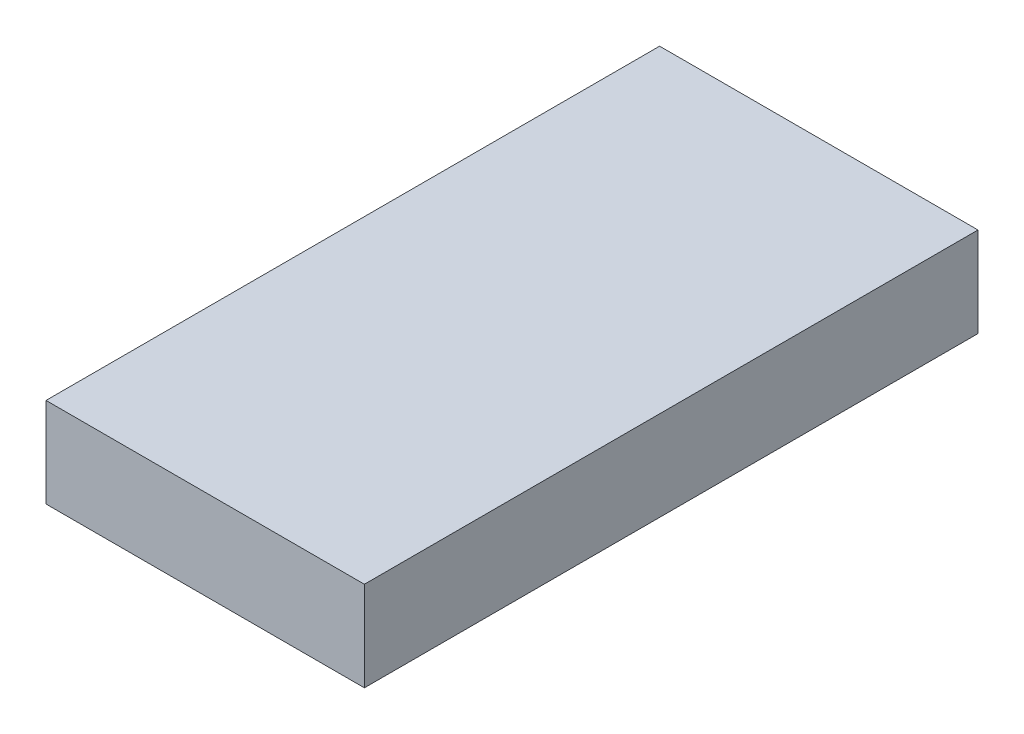
from build123d import *

# Parameters (mm, degrees)
SKETCH1_W           = 43.999912
SKETCH1_H           = 84.7979
BOSS_EXTRUDE1_DEPTH = 12.4000006
SKETCH2_W           = 0.569871795
SKETCH2_H           = 3.256410256
SKETCH2_W_2         = 0.569871794
CUT_EXTRUDE1_DEPTH  = 0.254


with BuildPart() as part:
    # Sketch1 → Boss-Extrude1 (new body)
    with BuildSketch(Plane(origin=(0, 0, 0), x_dir=(1, 0, 0), z_dir=(0, 1, 0))):
        with Locations((0.101597209, -0.465922527)):
            Rectangle(SKETCH1_W, SKETCH1_H)
    extrude(amount=BOSS_EXTRUDE1_DEPTH)

    # Sketch2 → Cut-Extrude1 (cut)
    # profile 1 of 10: a face of its own
    with BuildSketch(Plane.ZY.offset(21.898358791)):
        with BuildLine():
            Line((8.672564835, 8.520192608), (9.161026374, 8.520192608))
            Line((9.161026374, 8.520192608), (9.161026374, 8.234620693))
            add(Edge.make_bspline(
                [(9.161026374, 8.234620693), (9.174844013, 8.259999547), (9.201851162, 8.309603572), (9.25146556, 8.376187151), (9.30846459, 8.432261984), (9.3708001, 8.479000926), (9.438661017, 8.515429343), (9.510230148, 8.541389182), (9.584895218, 8.55825948), (9.635829198, 8.560011985), (9.661572247, 8.560897736)],
                knots=[0, 0, 0, 0, 1.09866127, 2.147379032, 3.14564304, 4.131443017, 5.102343063, 6.064490016, 7.021754664, 8, 8, 8, 8], degree=3))
            add(Edge.make_bspline(
                [(9.661572247, 8.560897736), (9.680264913, 8.560022429), (9.718329855, 8.558239991), (9.776346183, 8.547878655), (9.835199585, 8.529143387), (9.873930196, 8.512274769), (9.893718681, 8.503656149)],
                knots=[0, 0, 0, 0, 0.931404136, 1.896671404, 2.925354185, 4, 4, 4, 4], degree=3))
            Line((9.893718681, 8.503656149), (9.716905781, 8.02091877))
            add(Edge.make_bspline(
                [(9.716905781, 8.02091877), (9.701101232, 8.028554763), (9.671394765, 8.042907492), (9.628266133, 8.05984519), (9.589125111, 8.070179746), (9.564310422, 8.071721752), (9.552813233, 8.072436197)],
                knots=[0, 0, 0, 0, 1.214386998, 2.282580073, 3.20428172, 4, 4, 4, 4], degree=3))
            add(Edge.make_bspline(
                [(9.552813233, 8.072436197), (9.54195765, 8.071962768), (9.520602849, 8.071031451), (9.48908376, 8.063050383), (9.459399341, 8.049287277), (9.430119103, 8.031655373), (9.403552931, 8.007145707), (9.377003168, 7.978771418), (9.353606096, 7.943739583), (9.328915399, 7.904747372), (9.307892154, 7.857020941), (9.289865368, 7.800045417), (9.273803357, 7.733161555), (9.262750501, 7.656014234), (9.252067471, 7.569349987), (9.24570867, 7.472532711), (9.240969375, 7.365868549), (9.240679599, 7.291413115), (9.240528577, 7.252609475)],
                knots=[0, 0, 0, 0, 0.544232178, 1.070598461, 1.618251235, 2.182094276, 2.777567932, 3.425210017, 4.127676488, 4.886675562, 5.738955394, 6.734782583, 7.883056018, 9.186093582, 10.642914445, 12.264202625, 14.053029461, 16, 16, 16, 16], degree=3))
            Line((9.240528577, 7.252609475), (9.24243663, 7.139398337))
            Line((9.24243663, 7.139398337), (9.24243663, 6.2000003))
            Line((9.24243663, 6.2000003), (8.672564835, 6.2000003))
            Line((8.672564835, 6.2000003), (8.672564835, 8.520192608))
        make_face()
    # profile 2 of 10: a face of its own
    with BuildSketch(Plane.ZY.offset(21.898358791)):
        with BuildLine():
            Line((8.2636055, 7.217628505), (6.433782784, 7.217628505))
            add(Edge.make_bspline(
                [(6.433782784, 7.217628505), (6.437513645, 7.196367003), (6.44484508, 7.154586475), (6.460765554, 7.093896631), (6.481082465, 7.036703548), (6.505431005, 6.98293077), (6.533400655, 6.932294023), (6.566024936, 6.885030813), (6.602890036, 6.841182885), (6.643782813, 6.800940808), (6.688021657, 6.764883035), (6.735392027, 6.733294146), (6.785942806, 6.70739319), (6.839094449, 6.685561371), (6.89524412, 6.668268359), (6.954474458, 6.656341698), (7.016628451, 6.649296575), (7.058969651, 6.648277579), (7.080612712, 6.64775671)],
                knots=[0, 0, 0, 0, 1.091296461, 2.144483647, 3.168565212, 4.157007626, 5.126487748, 6.090021542, 7.05641414, 8.019231907, 8.98705074, 9.938580405, 10.892824166, 11.854447369, 12.841318655, 13.858982407, 14.905600794, 16, 16, 16, 16], degree=3))
            add(Edge.make_bspline(
                [(7.080612712, 6.64775671), (7.106737356, 6.648446426), (7.158184474, 6.64980468), (7.233554884, 6.661850372), (7.30644905, 6.68004486), (7.376177136, 6.707101592), (7.443546832, 6.740782467), (7.507449027, 6.782744692), (7.568989816, 6.831761996), (7.60653695, 6.869544514), (7.625679819, 6.888807391)],
                knots=[0, 0, 0, 0, 1.021034703, 2.010718019, 2.977989445, 3.954245119, 4.929443971, 5.918328161, 6.938689359, 8, 8, 8, 8], degree=3))
            Line((7.625679819, 6.888807391), (8.10269304, 6.661749098))
            add(Edge.make_bspline(
                [(8.10269304, 6.661749098), (8.087674557, 6.64099586), (8.057915986, 6.599874081), (8.009336117, 6.542005118), (7.95863993, 6.488011028), (7.905789616, 6.438246938), (7.850718148, 6.392854657), (7.793578721, 6.351281223), (7.733536266, 6.314642868), (7.671791321, 6.28116705), (7.607067504, 6.252468386), (7.539543934, 6.227995178), (7.469506611, 6.205871607), (7.396071115, 6.189014658), (7.319848943, 6.175670834), (7.240657757, 6.166194951), (7.158507993, 6.160342153), (7.102671278, 6.159648311), (7.074252535, 6.159295172)],
                knots=[0, 0, 0, 0, 1.028154879, 2.037251081, 3.030720504, 4.000128189, 4.949298328, 5.894184978, 6.834267904, 7.770992897, 8.712077017, 9.673380525, 10.653304757, 11.658697181, 12.695551717, 13.758623199, 14.859225354, 16, 16, 16, 16], degree=3))
            add(Edge.make_bspline(
                [(7.074252535, 6.159295172), (7.030530767, 6.160186527), (6.944904204, 6.161932195), (6.819659876, 6.178134493), (6.700712502, 6.204999648), (6.587726217, 6.241518701), (6.481189422, 6.289735292), (6.381049392, 6.348708182), (6.286305585, 6.417306744), (6.199852953, 6.496970677), (6.121092054, 6.583680133), (6.051913378, 6.676800167), (5.994025647, 6.775680186), (5.946487078, 6.87966578), (5.909538451, 6.989023111), (5.882900634, 7.103799902), (5.866571333, 7.223941333), (5.864807687, 7.305771058), (5.863910989, 7.347376101)],
                knots=[0, 0, 0, 0, 1.103565453, 2.161269334, 3.182010356, 4.179077853, 5.15417608, 6.128274628, 7.109042802, 8.101804412, 9.090965879, 10.063106201, 11.02526161, 11.978650795, 12.945248442, 13.93468508, 14.949922959, 16, 16, 16, 16], degree=3))
            add(Edge.make_bspline(
                [(5.863910989, 7.347376101), (5.864816512, 7.390038382), (5.866598089, 7.473974503), (5.882760038, 7.596890054), (5.909612095, 7.714168115), (5.946668805, 7.82597019), (5.993486208, 7.932645947), (6.052110462, 8.033262103), (6.121057725, 8.128168947), (6.199534889, 8.216922496), (6.286353761, 8.29703227), (6.378607015, 8.368426089), (6.477331211, 8.427916157), (6.581409693, 8.475984095), (6.690176737, 8.515038082), (6.80488954, 8.541025248), (6.92467531, 8.558474075), (7.006558225, 8.560081003), (7.048175813, 8.560897736)],
                knots=[0, 0, 0, 0, 1.079208495, 2.12329425, 3.130605359, 4.119693003, 5.099659317, 6.073216462, 7.060498243, 8.06384408, 9.066070512, 10.045757761, 11.010926815, 11.975797609, 12.942977511, 13.929384301, 14.947594487, 16, 16, 16, 16], degree=3))
            add(Edge.make_bspline(
                [(7.048175813, 8.560897736), (7.092107038, 8.559992552), (7.178361471, 8.558215316), (7.304478087, 8.542144578), (7.424215257, 8.515115601), (7.538083128, 8.478912322), (7.644627561, 8.429477729), (7.74618966, 8.371956069), (7.84033339, 8.301874697), (7.928062223, 8.222600613), (8.007255424, 8.134648765), (8.076479057, 8.039106119), (8.135379849, 7.936905117), (8.183119525, 7.827631311), (8.220030212, 7.711612753), (8.246692688, 7.589000114), (8.262897435, 7.459327036), (8.264628263, 7.370532448), (8.265513553, 7.325115484)],
                knots=[0, 0, 0, 0, 1.080001299, 2.120471247, 3.119684163, 4.095710327, 5.052285597, 6.002875087, 6.961153713, 7.931888285, 8.906493152, 9.865905668, 10.82813294, 11.801621613, 12.7925306, 13.817193356, 14.883530496, 16, 16, 16, 16], degree=3))
            Line((8.265513553, 7.325115484), (8.2636055, 7.217628505))
        make_face()
        with BuildLine():
            add(Edge.make_bspline(
                [(7.695641758, 7.665384915), (7.684887929, 7.694405145), (7.663506515, 7.75210492), (7.61520679, 7.831716531), (7.551114601, 7.900663419), (7.476570788, 7.961702647), (7.391399813, 8.011245896), (7.298285563, 8.047116818), (7.198404986, 8.068625472), (7.12969253, 8.07114806), (7.0946051, 8.072436197)],
                knots=[0, 0, 0, 0, 0.954238005, 1.897273737, 2.851915805, 3.847685534, 4.862635127, 5.880135777, 6.917509367, 8, 8, 8, 8], degree=3))
            add(Edge.make_bspline(
                [(7.0946051, 8.072436197), (7.056283912, 8.071198784), (6.981373971, 8.068779899), (6.87332148, 8.043054169), (6.77139827, 8.004659284), (6.711310121, 7.965073343), (6.681193641, 7.945232672)],
                knots=[0, 0, 0, 0, 1.044195649, 2.041185066, 3.018232172, 4, 4, 4, 4], degree=3))
            add(Edge.make_bspline(
                [(6.681193641, 7.945232672), (6.662403207, 7.930121582), (6.622342962, 7.897905511), (6.570316606, 7.833637507), (6.519070212, 7.755823382), (6.489933812, 7.696718057), (6.474487912, 7.665384915)],
                knots=[0, 0, 0, 0, 0.82159062, 1.751589201, 2.808063854, 4, 4, 4, 4], degree=3))
            Line((6.474487912, 7.665384915), (7.695641758, 7.665384915))
        make_face(mode=Mode.SUBTRACT)
    # profile 3 of 10: a face of its own
    with BuildSketch(Plane.ZY.offset(21.898358791)):
        with Locations((5.131218682, 7.828205428)):
            Rectangle(SKETCH2_W, SKETCH2_H)
    # profile 4 of 10: a face of its own
    with BuildSketch(Plane.ZY.offset(21.898358791)):
        with Locations((4.072885348, 7.828205428)):
            Rectangle(SKETCH2_W_2, SKETCH2_H)
    # profile 5 of 10: a face of its own
    with BuildSketch(Plane.ZY.offset(21.898358791)):
        with BuildLine():
            add(Edge.make_bspline(
                [(2.12539937, 8.560897736), (2.152341809, 8.560418277), (2.205700045, 8.55946873), (2.285170472, 8.551564624), (2.363251572, 8.53866875), (2.440392146, 8.521970843), (2.515875871, 8.498574578), (2.590098651, 8.470514375), (2.66372413, 8.438297982), (2.73492494, 8.399949205), (2.804215453, 8.358356458), (2.869906983, 8.312476247), (2.931454007, 8.262668943), (2.989999047, 8.210089369), (3.042813811, 8.152448381), (3.093273444, 8.092523364), (3.138651737, 8.028167413), (3.180665499, 7.960948735), (3.218070049, 7.891256042), (3.250549021, 7.81957414), (3.278737716, 7.746894084), (3.300808899, 7.67233058), (3.319081804, 7.596866846), (3.330613306, 7.519578132), (3.338811404, 7.441258387), (3.339730671, 7.388527089), (3.34019304, 7.362004507)],
                knots=[0, 0, 0, 0, 1.022364134, 2.024744242, 3.027414945, 4.024939316, 5.017584196, 6.023349371, 7.035562955, 8.064994934, 9.090267829, 10.101425541, 11.102933353, 12.093946398, 13.084502048, 14.067315274, 15.065326281, 16.070028806, 17.074376865, 18.064572984, 19.055292013, 20.030201733, 21.013838017, 21.999348303, 22.993720005, 24, 24, 24, 24], degree=3))
            add(Edge.make_bspline(
                [(3.34019304, 7.362004507), (3.339705086, 7.335274716), (3.338734923, 7.282129834), (3.330909903, 7.203073395), (3.317964667, 7.125421228), (3.301202673, 7.048715872), (3.277893963, 6.973938844), (3.250660224, 6.899987902), (3.217229738, 6.827871025), (3.180269872, 6.756801486), (3.137985979, 6.688870645), (3.092646967, 6.623870003), (3.042398683, 6.563504833), (2.990006716, 6.505903044), (2.932985997, 6.45301247), (2.872246682, 6.403974309), (2.808314605, 6.358189047), (2.740730028, 6.316730894), (2.670358596, 6.280303094), (2.598387109, 6.247460459), (2.524394719, 6.22011662), (2.448534557, 6.197818472), (2.370760616, 6.180553575), (2.291244601, 6.168825325), (2.21015776, 6.160668462), (2.15552464, 6.159755882), (2.127943441, 6.159295172)],
                knots=[0, 0, 0, 0, 1.012026251, 2.012137606, 3.004615893, 3.992048833, 4.982446996, 5.968083444, 6.973977695, 7.990229942, 8.999482246, 10.001782172, 10.988562221, 11.971415814, 12.948383116, 13.930088534, 14.925840678, 15.924049238, 16.929462851, 17.924729459, 18.917889337, 19.913673841, 20.916777188, 21.931792057, 22.95587778, 24, 24, 24, 24], degree=3))
            add(Edge.make_bspline(
                [(2.127943441, 6.159295172), (2.087614104, 6.160478917), (2.008124366, 6.162812098), (1.891054776, 6.178793774), (1.778589545, 6.206302429), (1.670545413, 6.244648888), (1.566782027, 6.293788446), (1.468204952, 6.354606111), (1.373833614, 6.425904557), (1.285302596, 6.507081164), (1.20419619, 6.596139254), (1.133339987, 6.691208221), (1.073177336, 6.790863143), (1.023762366, 6.895217659), (0.985624086, 7.004414868), (0.958081741, 7.118128309), (0.942080525, 7.236677612), (0.939767077, 7.317223429), (0.938590476, 7.358188401)],
                knots=[0, 0, 0, 0, 1.029999031, 2.030143771, 3.011211297, 3.982305373, 4.953580601, 5.938004764, 6.935448627, 7.970290061, 9.001484052, 10.007591832, 10.993831261, 11.969999897, 12.951306496, 13.942897864, 14.953773953, 16, 16, 16, 16], degree=3))
            add(Edge.make_bspline(
                [(0.938590476, 7.358188401), (0.939808109, 7.401930011), (0.942201342, 7.48790327), (0.961204665, 7.613856053), (0.991550921, 7.734449874), (1.035111061, 7.849347393), (1.090755309, 7.958760524), (1.158684324, 8.062458501), (1.239233817, 8.160464815), (1.300918599, 8.219742393), (1.332285388, 8.249885116)],
                knots=[0, 0, 0, 0, 1.043912699, 2.05178951, 3.033892, 4.007821512, 4.978932272, 5.95884105, 6.962068106, 8, 8, 8, 8], degree=3))
            add(Edge.make_bspline(
                [(1.332285388, 8.249885116), (1.361067553, 8.274870043), (1.417848805, 8.324160131), (1.510099652, 8.386676528), (1.604554109, 8.440671622), (1.702344255, 8.485065632), (1.803742702, 8.518537999), (1.908229841, 8.542902888), (2.015783946, 8.557868516), (2.088675212, 8.559882865), (2.12539937, 8.560897736)],
                knots=[0, 0, 0, 0, 1.048115528, 2.067714963, 3.060638214, 4.039924844, 5.017819947, 5.994373833, 6.98952318, 8, 8, 8, 8], degree=3))
        make_face()
        with BuildLine():
            add(Edge.make_bspline(
                [(2.138119723, 8.031731069), (2.116055851, 8.030997739), (2.072622881, 8.029554171), (2.008688409, 8.021806927), (1.948218512, 8.005928285), (1.890012145, 7.985734997), (1.835098984, 7.958729321), (1.781975154, 7.927126456), (1.733402978, 7.887579359), (1.687031891, 7.844199087), (1.64493728, 7.79602646), (1.609068675, 7.743542418), (1.577019281, 7.688754891), (1.552717852, 7.62965804), (1.532606095, 7.567867154), (1.5189947, 7.502383878), (1.509522119, 7.433939698), (1.508818914, 7.387054965), (1.508462271, 7.363276542)],
                knots=[0, 0, 0, 0, 1.030650113, 2.02884584, 2.99876339, 3.944280128, 4.900564847, 5.851248946, 6.823638398, 7.81794922, 8.81432732, 9.802856497, 10.78262424, 11.771747962, 12.779760563, 13.812642396, 14.89064281, 16, 16, 16, 16], degree=3))
            add(Edge.make_bspline(
                [(1.508462271, 7.363276542), (1.508879592, 7.338659572), (1.509695165, 7.290550431), (1.518140594, 7.220304616), (1.532067385, 7.153641802), (1.551852991, 7.090664971), (1.576736731, 7.030922082), (1.607266194, 6.974748332), (1.643763585, 6.922481474), (1.685142768, 6.874185869), (1.730451206, 6.830347414), (1.780096651, 6.792726892), (1.832000137, 6.760039652), (1.887357803, 6.733786753), (1.945383412, 6.713517385), (2.006249217, 6.698593731), (2.070275069, 6.69055359), (2.113930581, 6.689168677), (2.13621167, 6.688461838)],
                knots=[0, 0, 0, 0, 1.141730614, 2.231293227, 3.276944405, 4.297399982, 5.28939179, 6.275415646, 7.257752684, 8.24146775, 9.222424823, 10.176631434, 11.126518621, 12.063689483, 13.012557477, 13.974037417, 14.965980454, 16, 16, 16, 16], degree=3))
            add(Edge.make_bspline(
                [(2.13621167, 6.688461838), (2.158503903, 6.689088772), (2.202209621, 6.690317925), (2.266310659, 6.699522344), (2.32748729, 6.714008284), (2.386008483, 6.734452103), (2.441401088, 6.761266932), (2.493877154, 6.794110552), (2.543898319, 6.832254341), (2.589814801, 6.876919944), (2.63231881, 6.925366166), (2.669592284, 6.977908938), (2.700739404, 7.034082701), (2.72628562, 7.093534012), (2.746110012, 7.156181153), (2.759806243, 7.222256977), (2.769283888, 7.291556709), (2.769971189, 7.339074684), (2.770321245, 7.363276542)],
                knots=[0, 0, 0, 0, 1.031504075, 2.022346795, 2.991027682, 3.937587355, 4.885570121, 5.833146507, 6.798790848, 7.791235734, 8.792807298, 9.778388351, 10.766749885, 11.760164525, 12.768777521, 13.802286646, 14.880660483, 16, 16, 16, 16], degree=3))
            add(Edge.make_bspline(
                [(2.770321245, 7.363276542), (2.769898616, 7.387469942), (2.76906928, 7.43494524), (2.760623249, 7.504338699), (2.746833131, 7.570200947), (2.726792335, 7.632250758), (2.7020565, 7.691196021), (2.671505935, 7.746735019), (2.634828551, 7.798594206), (2.593248212, 7.846516436), (2.547260572, 7.889739738), (2.498477092, 7.928284431), (2.445782245, 7.960163853), (2.390164616, 7.986443876), (2.331476234, 8.006662603), (2.269782987, 8.021670833), (2.204895804, 8.029596567), (2.160611047, 8.031012132), (2.138119723, 8.031731069)],
                knots=[0, 0, 0, 0, 1.123894411, 2.205445421, 3.243160173, 4.246488011, 5.231014757, 6.210004299, 7.185865357, 8.177612767, 9.153374344, 10.115157457, 11.061423229, 12.009021698, 12.96873347, 13.94135618, 14.954456845, 16, 16, 16, 16], degree=3))
        make_face(mode=Mode.SUBTRACT)
    # profile 6 of 10: a face of its own
    with BuildSketch(Plane.ZY.offset(21.898358791)):
        with BuildLine():
            Line((-0.486089011, 8.520192608), (0.002372527, 8.520192608))
            Line((0.002372527, 8.520192608), (0.002372527, 8.234620693))
            add(Edge.make_bspline(
                [(0.002372527, 8.234620693), (0.016190167, 8.259999547), (0.043197316, 8.309603572), (0.092811714, 8.376187151), (0.149810743, 8.432261984), (0.212146254, 8.479000926), (0.280007171, 8.515429343), (0.351576302, 8.541389182), (0.426241372, 8.55825948), (0.477175352, 8.560011985), (0.502918401, 8.560897736)],
                knots=[0, 0, 0, 0, 1.09866127, 2.147379032, 3.14564304, 4.131443017, 5.102343063, 6.064490016, 7.021754664, 8, 8, 8, 8], degree=3))
            add(Edge.make_bspline(
                [(0.502918401, 8.560897736), (0.521611067, 8.560022429), (0.559676009, 8.558239991), (0.617692337, 8.547878655), (0.676545739, 8.529143387), (0.715276349, 8.512274769), (0.735064835, 8.503656149)],
                knots=[0, 0, 0, 0, 0.931404136, 1.896671404, 2.925354185, 4, 4, 4, 4], degree=3))
            Line((0.735064835, 8.503656149), (0.558251935, 8.02091877))
            add(Edge.make_bspline(
                [(0.558251935, 8.02091877), (0.542447386, 8.028554763), (0.512740919, 8.042907492), (0.469612287, 8.05984519), (0.430471265, 8.070179746), (0.405656576, 8.071721752), (0.394159386, 8.072436197)],
                knots=[0, 0, 0, 0, 1.214386998, 2.282580073, 3.20428172, 4, 4, 4, 4], degree=3))
            add(Edge.make_bspline(
                [(0.394159386, 8.072436197), (0.383303804, 8.071962768), (0.361949003, 8.071031451), (0.330429914, 8.063050383), (0.300745495, 8.049287277), (0.271465257, 8.031655373), (0.244899085, 8.007145707), (0.218349322, 7.978771418), (0.19495225, 7.943739583), (0.170261553, 7.904747372), (0.149238307, 7.857020941), (0.131211522, 7.800045417), (0.115149511, 7.733161555), (0.104096655, 7.656014234), (0.093413625, 7.569349987), (0.087054824, 7.472532711), (0.082315529, 7.365868549), (0.082025752, 7.291413115), (0.081874731, 7.252609475)],
                knots=[0, 0, 0, 0, 0.544232178, 1.070598461, 1.618251235, 2.182094276, 2.777567932, 3.425210017, 4.127676488, 4.886675562, 5.738955394, 6.734782583, 7.883056018, 9.186093582, 10.642914445, 12.264202625, 14.053029461, 16, 16, 16, 16], degree=3))
            Line((0.081874731, 7.252609475), (0.083782784, 7.139398337))
            Line((0.083782784, 7.139398337), (0.083782784, 6.2000003))
            Line((0.083782784, 6.2000003), (-0.486089011, 6.2000003))
            Line((-0.486089011, 6.2000003), (-0.486089011, 8.520192608))
        make_face()
    # profile 7 of 10: a face of its own
    with BuildSketch(Plane.ZY.offset(21.898358791)):
        Polygon((-1.666537729, 9.456410556), (-1.096665934, 9.456410556), (-1.096665934, 8.520192608), (-0.73031978, 8.520192608), (-0.73031978, 8.031731069), (-1.096665934, 8.031731069), (-1.096665934, 6.2000003), (-1.666537729, 6.2000003), (-1.666537729, 8.031731069), (-1.951473626, 8.031731069), (-1.951473626, 8.520192608), (-1.666537729, 8.520192608), align=None)
    # profile 8 of 10: a face of its own
    with BuildSketch(Plane.ZY.offset(21.898358791)):
        with BuildLine():
            Line((-4.35307619, 8.520192608), (-3.783204396, 8.520192608))
            Line((-3.783204396, 8.520192608), (-3.783204396, 8.274689803))
            add(Edge.make_bspline(
                [(-3.783204396, 8.274689803), (-3.750693492, 8.299977453), (-3.688558836, 8.348307069), (-3.59410343, 8.409927575), (-3.504949222, 8.460361485), (-3.419108868, 8.498724097), (-3.33496728, 8.526324347), (-3.251161724, 8.546153481), (-3.166444166, 8.55885062), (-3.109493404, 8.56021573), (-3.081040934, 8.560897736)],
                knots=[0, 0, 0, 0, 1.276643801, 2.439914479, 3.493451431, 4.44993799, 5.350072675, 6.235028322, 7.118224225, 8, 8, 8, 8], degree=3))
            add(Edge.make_bspline(
                [(-3.081040934, 8.560897736), (-3.052179733, 8.560118344), (-2.99552277, 8.558588333), (-2.912098515, 8.547887145), (-2.832394741, 8.528396891), (-2.755515245, 8.502519106), (-2.682242528, 8.468361913), (-2.611678955, 8.427805789), (-2.545340208, 8.378405685), (-2.50448587, 8.340784938), (-2.483820381, 8.321755108)],
                knots=[0, 0, 0, 0, 1.048836932, 2.058954983, 3.049370783, 4.026390553, 5.001981509, 5.982488534, 6.97947532, 8, 8, 8, 8], degree=3))
            add(Edge.make_bspline(
                [(-2.483820381, 8.321755108), (-2.467245899, 8.30412002), (-2.433975628, 8.268720776), (-2.392109173, 8.208143603), (-2.356183045, 8.142103397), (-2.326746575, 8.069838362), (-2.30499421, 7.990951449), (-2.288259819, 7.906395499), (-2.27886986, 7.815697062), (-2.277710625, 7.753388091), (-2.277114652, 7.721354467)],
                knots=[0, 0, 0, 0, 0.889584746, 1.785680191, 2.700364693, 3.65222533, 4.649950538, 5.707241244, 6.821271309, 8, 8, 8, 8], degree=3))
            Line((-2.277114652, 7.721354467), (-2.277114652, 6.2000003))
            Line((-2.277114652, 6.2000003), (-2.846986447, 6.2000003))
            Line((-2.846986447, 6.2000003), (-2.846986447, 7.207452223))
            add(Edge.make_bspline(
                [(-2.846986447, 7.207452223), (-2.847106962, 7.24031355), (-2.847337907, 7.303286183), (-2.849111056, 7.393409485), (-2.852573274, 7.47480253), (-2.855728995, 7.547613513), (-2.861924932, 7.611583903), (-2.867512527, 7.667118684), (-2.87608615, 7.713714039), (-2.887241825, 7.763834335), (-2.906722381, 7.817497278), (-2.936964994, 7.874040053), (-2.97533199, 7.922074401), (-3.020256307, 7.961937066), (-3.071688331, 7.993472091), (-3.129006579, 8.015658945), (-3.191903758, 8.029486338), (-3.235729773, 8.030963788), (-3.258489852, 8.031731069)],
                knots=[0, 0, 0, 0, 1.49886392, 2.872294502, 4.110984203, 5.214877267, 6.195405875, 7.042225351, 7.75923308, 8.355011229, 9.382752534, 10.352059385, 11.267231453, 12.171456522, 13.078624015, 14.003401117, 14.963110155, 16, 16, 16, 16], degree=3))
            add(Edge.make_bspline(
                [(-3.258489852, 8.031731069), (-3.288090293, 8.030230023), (-3.345994511, 8.027293685), (-3.429741377, 8.005151015), (-3.506661478, 7.967492851), (-3.576126314, 7.915381525), (-3.63747429, 7.851043635), (-3.688002111, 7.774313321), (-3.729445303, 7.687042465), (-3.747266492, 7.623320564), (-3.756491655, 7.590334835)],
                knots=[0, 0, 0, 0, 0.984188326, 1.925263693, 2.85911992, 3.81709677, 4.80007086, 5.801799564, 6.862098548, 8, 8, 8, 8], degree=3))
            add(Edge.make_bspline(
                [(-3.756491655, 7.590334835), (-3.758784475, 7.579975446), (-3.763897923, 7.556871926), (-3.768103087, 7.517841053), (-3.773952776, 7.471534701), (-3.776144511, 7.417114856), (-3.779955696, 7.354839065), (-3.781365255, 7.284624937), (-3.782777335, 7.20661015), (-3.783057326, 7.152119786), (-3.783204396, 7.123497896)],
                knots=[0, 0, 0, 0, 0.543362196, 1.211806945, 2.009705693, 2.934833164, 4.000995085, 5.207458376, 6.533175157, 8, 8, 8, 8], degree=3))
            Line((-3.783204396, 7.123497896), (-3.783204396, 6.2000003))
            Line((-3.783204396, 6.2000003), (-4.35307619, 6.2000003))
            Line((-4.35307619, 6.2000003), (-4.35307619, 8.520192608))
        make_face()
    # profile 9 of 10: a face of its own
    with BuildSketch(Plane.ZY.offset(21.898358791)):
        with BuildLine():
            add(Edge.make_bspline(
                [(-6.056331399, 8.560897736), (-6.02938896, 8.560418277), (-5.976030724, 8.55946873), (-5.896560298, 8.551564624), (-5.818479197, 8.53866875), (-5.741338623, 8.521970843), (-5.665854898, 8.498574578), (-5.591632118, 8.470514375), (-5.518006639, 8.438297982), (-5.446805829, 8.399949205), (-5.377515316, 8.358356458), (-5.311823787, 8.312476247), (-5.250276762, 8.262668943), (-5.191731722, 8.210089369), (-5.138916958, 8.152448381), (-5.088457325, 8.092523364), (-5.043079032, 8.028167413), (-5.00106527, 7.960948735), (-4.96366072, 7.891256042), (-4.931181748, 7.81957414), (-4.902993053, 7.746894084), (-4.88092187, 7.67233058), (-4.862648965, 7.596866846), (-4.851117463, 7.519578132), (-4.842919365, 7.441258387), (-4.842000098, 7.388527089), (-4.841537729, 7.362004507)],
                knots=[0, 0, 0, 0, 1.022364134, 2.024744242, 3.027414945, 4.024939316, 5.017584196, 6.023349371, 7.035562955, 8.064994934, 9.090267829, 10.101425541, 11.102933353, 12.093946398, 13.084502048, 14.067315274, 15.065326281, 16.070028806, 17.074376865, 18.064572984, 19.055292013, 20.030201733, 21.013838017, 21.999348303, 22.993720005, 24, 24, 24, 24], degree=3))
            add(Edge.make_bspline(
                [(-4.841537729, 7.362004507), (-4.842025683, 7.335274716), (-4.842995846, 7.282129834), (-4.850820866, 7.203073395), (-4.863766102, 7.125421228), (-4.880528096, 7.048715872), (-4.903836806, 6.973938844), (-4.931070545, 6.899987902), (-4.964501031, 6.827871025), (-5.001460897, 6.756801486), (-5.04374479, 6.688870645), (-5.089083802, 6.623870003), (-5.139332086, 6.563504833), (-5.191724053, 6.505903044), (-5.248744772, 6.45301247), (-5.309484087, 6.403974309), (-5.373416164, 6.358189047), (-5.441000741, 6.316730894), (-5.511372174, 6.280303094), (-5.58334366, 6.247460459), (-5.65733605, 6.22011662), (-5.733196212, 6.197818472), (-5.810970153, 6.180553575), (-5.890486168, 6.168825325), (-5.971573009, 6.160668462), (-6.026206129, 6.159755882), (-6.053787328, 6.159295172)],
                knots=[0, 0, 0, 0, 1.012026251, 2.012137606, 3.004615893, 3.992048833, 4.982446996, 5.968083444, 6.973977695, 7.990229942, 8.999482246, 10.001782172, 10.988562221, 11.971415814, 12.948383116, 13.930088534, 14.925840678, 15.924049238, 16.929462851, 17.924729459, 18.917889337, 19.913673841, 20.916777188, 21.931792057, 22.95587778, 24, 24, 24, 24], degree=3))
            add(Edge.make_bspline(
                [(-6.053787328, 6.159295172), (-6.094116666, 6.160478917), (-6.173606403, 6.162812098), (-6.290675993, 6.178793774), (-6.403141224, 6.206302429), (-6.511185357, 6.244648888), (-6.614948742, 6.293788446), (-6.713525817, 6.354606111), (-6.807897155, 6.425904557), (-6.896428173, 6.507081164), (-6.977534579, 6.596139254), (-7.048390782, 6.691208221), (-7.108553433, 6.790863143), (-7.157968403, 6.895217659), (-7.196106683, 7.004414868), (-7.223649029, 7.118128309), (-7.239650244, 7.236677612), (-7.241963692, 7.317223429), (-7.243140293, 7.358188401)],
                knots=[0, 0, 0, 0, 1.029999031, 2.030143771, 3.011211297, 3.982305373, 4.953580601, 5.938004764, 6.935448627, 7.970290061, 9.001484052, 10.007591832, 10.993831261, 11.969999897, 12.951306496, 13.942897864, 14.953773953, 16, 16, 16, 16], degree=3))
            add(Edge.make_bspline(
                [(-7.243140293, 7.358188401), (-7.24192266, 7.401930011), (-7.239529427, 7.48790327), (-7.220526104, 7.613856053), (-7.190179848, 7.734449874), (-7.146619708, 7.849347393), (-7.090975461, 7.958760524), (-7.023046445, 8.062458501), (-6.942496952, 8.160464815), (-6.88081217, 8.219742393), (-6.849445381, 8.249885116)],
                knots=[0, 0, 0, 0, 1.043912699, 2.05178951, 3.033892, 4.007821512, 4.978932272, 5.95884105, 6.962068106, 8, 8, 8, 8], degree=3))
            add(Edge.make_bspline(
                [(-6.849445381, 8.249885116), (-6.820663217, 8.274870043), (-6.763881964, 8.324160131), (-6.671631117, 8.386676528), (-6.57717666, 8.440671622), (-6.479386514, 8.485065632), (-6.377988067, 8.518537999), (-6.273500928, 8.542902888), (-6.165946823, 8.557868516), (-6.093055558, 8.559882865), (-6.056331399, 8.560897736)],
                knots=[0, 0, 0, 0, 1.048115528, 2.067714963, 3.060638214, 4.039924844, 5.017819947, 5.994373833, 6.98952318, 8, 8, 8, 8], degree=3))
        make_face()
        with BuildLine():
            add(Edge.make_bspline(
                [(-6.043611046, 8.031731069), (-6.065674918, 8.030997739), (-6.109107888, 8.029554171), (-6.17304236, 8.021806927), (-6.233512258, 8.005928285), (-6.291718625, 7.985734997), (-6.346631785, 7.958729321), (-6.399755615, 7.927126456), (-6.448327792, 7.887579359), (-6.494698878, 7.844199087), (-6.536793489, 7.79602646), (-6.572662094, 7.743542418), (-6.604711488, 7.688754891), (-6.629012918, 7.62965804), (-6.649124674, 7.567867154), (-6.66273607, 7.502383878), (-6.67220865, 7.433939698), (-6.672911855, 7.387054965), (-6.673268498, 7.363276542)],
                knots=[0, 0, 0, 0, 1.030650113, 2.02884584, 2.99876339, 3.944280128, 4.900564847, 5.851248946, 6.823638398, 7.81794922, 8.81432732, 9.802856497, 10.78262424, 11.771747962, 12.779760563, 13.812642396, 14.89064281, 16, 16, 16, 16], degree=3))
            add(Edge.make_bspline(
                [(-6.673268498, 7.363276542), (-6.672851178, 7.338659572), (-6.672035605, 7.290550431), (-6.663590175, 7.220304616), (-6.649663384, 7.153641802), (-6.629877778, 7.090664971), (-6.604994038, 7.030922082), (-6.574464575, 6.974748332), (-6.537967184, 6.922481474), (-6.496588001, 6.874185869), (-6.451279563, 6.830347414), (-6.401634119, 6.792726892), (-6.349730632, 6.760039652), (-6.294372966, 6.733786753), (-6.236347358, 6.713517385), (-6.175481552, 6.698593731), (-6.111455701, 6.69055359), (-6.067800188, 6.689168677), (-6.045519099, 6.688461838)],
                knots=[0, 0, 0, 0, 1.141730614, 2.231293227, 3.276944405, 4.297399982, 5.28939179, 6.275415646, 7.257752684, 8.24146775, 9.222424823, 10.176631434, 11.126518621, 12.063689483, 13.012557477, 13.974037417, 14.965980454, 16, 16, 16, 16], degree=3))
            add(Edge.make_bspline(
                [(-6.045519099, 6.688461838), (-6.023226866, 6.689088772), (-5.979521148, 6.690317925), (-5.91542011, 6.699522344), (-5.854243479, 6.714008284), (-5.795722287, 6.734452103), (-5.740329681, 6.761266932), (-5.687853615, 6.794110552), (-5.63783245, 6.832254341), (-5.591915968, 6.876919944), (-5.549411959, 6.925366166), (-5.512138486, 6.977908938), (-5.480991365, 7.034082701), (-5.455445149, 7.093534012), (-5.435620757, 7.156181153), (-5.421924527, 7.222256977), (-5.412446881, 7.291556709), (-5.41175958, 7.339074684), (-5.411409524, 7.363276542)],
                knots=[0, 0, 0, 0, 1.031504075, 2.022346795, 2.991027682, 3.937587355, 4.885570121, 5.833146507, 6.798790848, 7.791235734, 8.792807298, 9.778388351, 10.766749885, 11.760164525, 12.768777521, 13.802286646, 14.880660483, 16, 16, 16, 16], degree=3))
            add(Edge.make_bspline(
                [(-5.411409524, 7.363276542), (-5.411832153, 7.387469942), (-5.412661489, 7.43494524), (-5.42110752, 7.504338699), (-5.434897638, 7.570200947), (-5.454938434, 7.632250758), (-5.479674269, 7.691196021), (-5.510224834, 7.746735019), (-5.546902219, 7.798594206), (-5.588482557, 7.846516436), (-5.634470197, 7.889739738), (-5.683253677, 7.928284431), (-5.735948525, 7.960163853), (-5.791566153, 7.986443876), (-5.850254535, 8.006662603), (-5.911947782, 8.021670833), (-5.976834966, 8.029596567), (-6.021119723, 8.031012132), (-6.043611046, 8.031731069)],
                knots=[0, 0, 0, 0, 1.123894411, 2.205445421, 3.243160173, 4.246488011, 5.231014757, 6.210004299, 7.185865357, 8.177612767, 9.153374344, 10.115157457, 11.061423229, 12.009021698, 12.96873347, 13.94135618, 14.954456845, 16, 16, 16, 16], degree=3))
        make_face(mode=Mode.SUBTRACT)
    # profile 10 of 10: a face of its own
    with BuildSketch(Plane.ZY.offset(21.898358791)):
        with BuildLine():
            Line((-7.650191575, 8.824209034), (-8.068055157, 8.424789963))
            add(Edge.make_bspline(
                [(-8.068055157, 8.424789963), (-8.10350175, 8.4614418), (-8.172740052, 8.53303432), (-8.284309012, 8.627816508), (-8.400336668, 8.706804636), (-8.518565934, 8.773327935), (-8.641123412, 8.823657552), (-8.766592003, 8.860333591), (-8.89577286, 8.882693586), (-8.983197496, 8.885251966), (-9.02716974, 8.886538762)],
                knots=[0, 0, 0, 0, 1.115251505, 2.178435587, 3.19620269, 4.182487026, 5.141301733, 6.088180966, 7.038406374, 8, 8, 8, 8], degree=3))
            add(Edge.make_bspline(
                [(-9.02716974, 8.886538762), (-9.063891907, 8.885522148), (-9.136359058, 8.883515972), (-9.242759826, 8.868808728), (-9.34453766, 8.843798419), (-9.44204096, 8.809329581), (-9.53498282, 8.764728733), (-9.623558104, 8.710030397), (-9.707548432, 8.645728575), (-9.785844342, 8.572155968), (-9.857466689, 8.491772366), (-9.920749593, 8.406003255), (-9.973759176, 8.315045126), (-10.017263279, 8.219819137), (-10.051151293, 8.119884535), (-10.075351593, 8.0153086), (-10.089348399, 7.905966789), (-10.091437517, 7.831637041), (-10.092499267, 7.793860476)],
                knots=[0, 0, 0, 0, 1.035432265, 2.043311493, 3.022114605, 3.98653278, 4.95457646, 5.923598177, 6.917315552, 7.932509744, 8.948865224, 9.949768934, 10.933144597, 11.912367597, 12.897413939, 13.903909035, 14.934704909, 16, 16, 16, 16], degree=3))
            add(Edge.make_bspline(
                [(-10.092499267, 7.793860476), (-10.092193283, 7.76734624), (-10.091590181, 7.715086136), (-10.084988167, 7.637778937), (-10.074357366, 7.562772678), (-10.058971965, 7.490180974), (-10.039732369, 7.419940915), (-10.017159942, 7.351446544), (-9.988843164, 7.285644299), (-9.957411114, 7.221769929), (-9.920856001, 7.161566328), (-9.881442846, 7.104157198), (-9.838705715, 7.049823952), (-9.792367796, 6.998788708), (-9.74177694, 6.951849031), (-9.688240735, 6.907593389), (-9.630856099, 6.867129651), (-9.570815055, 6.829442335), (-9.507598925, 6.796703043), (-9.44292291, 6.76704757), (-9.37580639, 6.742962916), (-9.30706655, 6.723548488), (-9.236949041, 6.707039417), (-9.16476805, 6.696874274), (-9.091149294, 6.689176331), (-9.041395372, 6.688701028), (-9.01635744, 6.688461838)],
                knots=[0, 0, 0, 0, 1.103660481, 2.175337485, 3.227646561, 4.255952547, 5.262355991, 6.258840057, 7.255597736, 8.242457506, 9.22035537, 10.185017736, 11.140346927, 12.096287581, 13.051739095, 14.01125915, 14.986044842, 15.97314143, 16.960198552, 17.947847494, 18.933482797, 19.925264591, 20.920966487, 21.929612487, 22.958107872, 24, 24, 24, 24], degree=3))
            add(Edge.make_bspline(
                [(-9.01635744, 6.688461838), (-8.973888807, 6.689690257), (-8.890448984, 6.692103779), (-8.767989048, 6.710977183), (-8.651296928, 6.742022864), (-8.558060483, 6.77868601), (-8.485012191, 6.814891342), (-8.429401606, 6.848379491), (-8.371895927, 6.885839663), (-8.313450274, 6.928685645), (-8.253407249, 6.976403268), (-8.192826751, 7.030037637), (-8.130157907, 7.087822648), (-8.089104169, 7.129064947), (-8.068055157, 7.150210637)],
                knots=[0, 0, 0, 0, 1.404581149, 2.759636711, 4.088442092, 5.392261763, 6.066678138, 6.783632037, 7.538459478, 8.336747902, 9.180226004, 10.074962426, 11.012997595, 12, 12, 12, 12], degree=3))
            Line((-8.068055157, 7.150210637), (-7.662911928, 6.724714843))
            add(Edge.make_bspline(
                [(-7.662911928, 6.724714843), (-7.691391316, 6.697218888), (-7.746976991, 6.643552663), (-7.83082644, 6.567351632), (-7.91457036, 6.498876535), (-7.996185674, 6.435642025), (-8.077009325, 6.379490279), (-8.157032743, 6.330365215), (-8.235350027, 6.28702439), (-8.31358746, 6.250198727), (-8.392231877, 6.218929914), (-8.47314774, 6.192009519), (-8.556582417, 6.169235833), (-8.643045488, 6.150860459), (-8.731730478, 6.13612589), (-8.823467362, 6.126180141), (-8.917674482, 6.119493945), (-8.981576631, 6.118893134), (-9.01381337, 6.118590044)],
                knots=[0, 0, 0, 0, 1.244526981, 2.429050516, 3.560637417, 4.644440555, 5.67424972, 6.652764056, 7.595344123, 8.486817594, 9.369275933, 10.254498637, 11.166417451, 12.086725134, 13.032340136, 13.991389299, 14.986715468, 16, 16, 16, 16], degree=3))
            add(Edge.make_bspline(
                [(-9.01381337, 6.118590044), (-9.073028267, 6.120099549), (-9.188895359, 6.123053233), (-9.358695563, 6.144938026), (-9.520001198, 6.181627496), (-9.673204692, 6.233516527), (-9.818257328, 6.299802332), (-9.955121999, 6.381065616), (-10.083578109, 6.477090476), (-10.202587984, 6.586751407), (-10.310238081, 6.707862699), (-10.4053883, 6.837903001), (-10.484096565, 6.977511414), (-10.549449733, 7.124625475), (-10.600555051, 7.279916522), (-10.636524531, 7.443552534), (-10.658706646, 7.61537551), (-10.661133401, 7.732734563), (-10.662371062, 7.792588441)],
                knots=[0, 0, 0, 0, 1.078019885, 2.10938526, 3.111377082, 4.085535484, 5.04941344, 6.010039228, 6.978205633, 7.964457913, 8.951525778, 9.924444315, 10.892603023, 11.863865945, 12.85144698, 13.863884204, 14.910567087, 16, 16, 16, 16], degree=3))
            add(Edge.make_bspline(
                [(-10.662371062, 7.792588441), (-10.661848087, 7.83162463), (-10.660811677, 7.908984815), (-10.649918917, 8.022942636), (-10.634733775, 8.134031127), (-10.610643929, 8.241096823), (-10.581605996, 8.345582094), (-10.545493511, 8.446351309), (-10.50236415, 8.543694088), (-10.453608075, 8.637773389), (-10.398450815, 8.727972892), (-10.3368341, 8.81351764), (-10.270344186, 8.895068024), (-10.197383427, 8.971542127), (-10.119012039, 9.043611405), (-10.034876184, 9.110885302), (-9.945481898, 9.174328601), (-9.850587223, 9.232305253), (-9.75203571, 9.284748216), (-9.651070352, 9.33100515), (-9.547939211, 9.369665294), (-9.443078334, 9.401732458), (-9.336044684, 9.425668328), (-9.227602242, 9.44378701), (-9.116828291, 9.453915469), (-9.04245318, 9.455573562), (-9.004909123, 9.456410556)],
                knots=[0, 0, 0, 0, 1.071919942, 2.124283339, 3.142214191, 4.149696895, 5.136002878, 6.119640489, 7.086990633, 8.058538607, 9.028339693, 9.988281803, 10.952401235, 11.916291999, 12.888973767, 13.874849856, 14.873389453, 15.898127285, 16.927174885, 17.938320013, 18.946391617, 19.950418109, 20.947802303, 21.956882652, 22.968648068, 24, 24, 24, 24], degree=3))
            add(Edge.make_bspline(
                [(-9.004909123, 9.456410556), (-8.972880193, 9.45593077), (-8.909155344, 9.454976187), (-8.81425835, 9.447018693), (-8.720120299, 9.434521529), (-8.627078232, 9.415665971), (-8.534466618, 9.39328204), (-8.443502477, 9.36397337), (-8.352750801, 9.331303334), (-8.263634895, 9.292252978), (-8.176030366, 9.249625986), (-8.091989488, 9.201264116), (-8.010101224, 9.150143502), (-7.932180166, 9.093238604), (-7.856766688, 9.032613468), (-7.784255131, 8.967985243), (-7.715281827, 8.898276387), (-7.671998012, 8.849022965), (-7.650191575, 8.824209034)],
                knots=[0, 0, 0, 0, 0.996412454, 1.982464992, 2.961075852, 3.949442424, 4.934965278, 5.923860011, 6.921385422, 7.934793307, 8.949617135, 9.951082467, 10.950285876, 11.951772932, 12.951063433, 13.960125323, 14.972308753, 16, 16, 16, 16], degree=3))
        make_face()
    extrude(amount=-CUT_EXTRUDE1_DEPTH, mode=Mode.SUBTRACT)


solid = part.part
